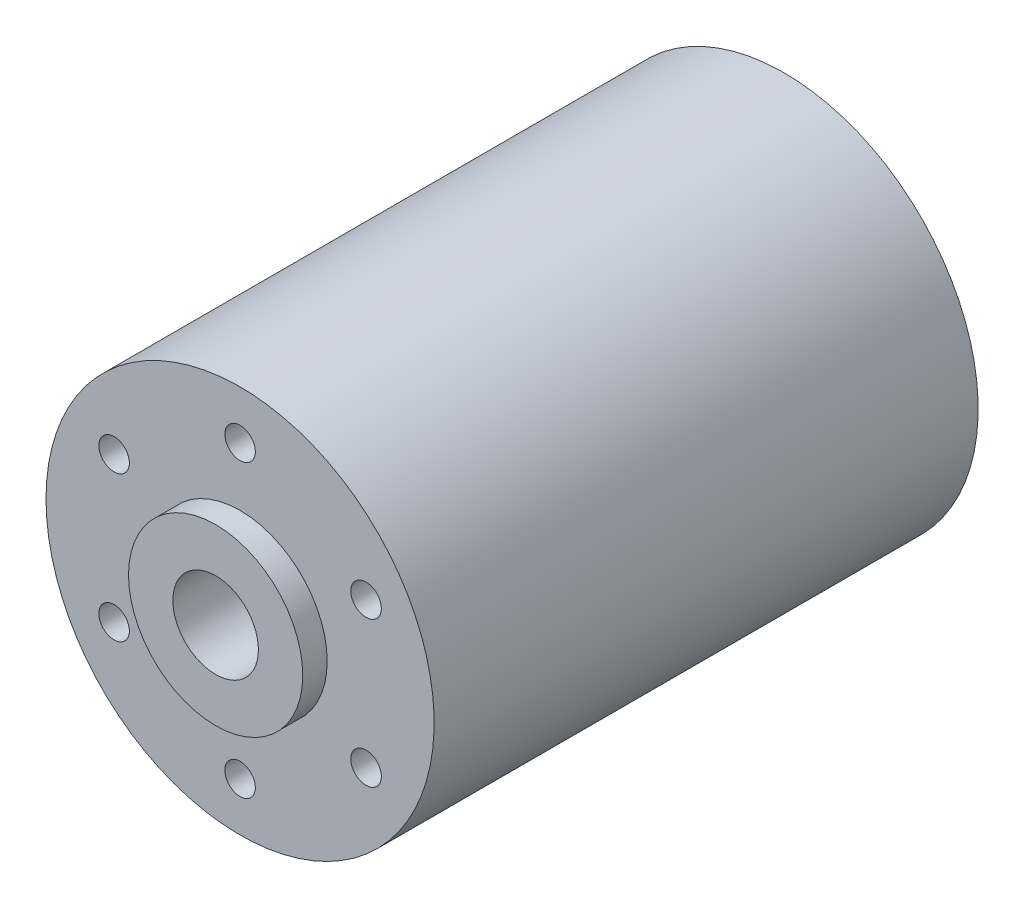
from build123d import *

# Parameters (mm, degrees)
CROQUIS3_R              = 31.75
SALIENTE_EXTRUIR3_DEPTH = 97
CROQUIS4_R              = 7
CORTAR_EXTRUIR1_DEPTH   = 107.888376356
CROQUIS8_R              = 2.5
CORTAR_EXTRUIR6_DEPTH   = 107.888376356
MATRIZC1_COUNT          = 6
CUT_EXTRUDE1_START      = -4
SKETCH1_R               = 31.75
SKETCH1_R_2             = 14.25
CUT_EXTRUDE1_DEPTH      = 4


with BuildPart() as part:
    # Croquis3 → Saliente-Extruir3 (new body)
    with BuildSketch(Plane.XY):
        with Locations(Location((0, 0, 0), (0, 0, 180))):
            Circle(CROQUIS3_R)
    extrude(amount=SALIENTE_EXTRUIR3_DEPTH)

    # Croquis4 → Cortar-Extruir1 (cut, through all)
    with BuildSketch(Plane.XY.offset(97)):
        Circle(CROQUIS4_R)
    extrude(amount=-CORTAR_EXTRUIR1_DEPTH, mode=Mode.SUBTRACT)

    # Croquis8 → Cortar-Extruir6 (cut, through all)
    with BuildSketch(Plane.XY.offset(97)):
        with Locations((0, 23.8)):
            Circle(CROQUIS8_R)
    cortar_extruir6 = extrude(amount=-CORTAR_EXTRUIR6_DEPTH, mode=Mode.SUBTRACT)

    # MatrizC1: Cortar-Extruir6 ×6 about axis
    matrizc1_axis = Axis((0, 0, 0), (0, 0, 1))
    for i in range(1, MATRIZC1_COUNT):
        add(cortar_extruir6.rotate(matrizc1_axis, i * 360 / MATRIZC1_COUNT), mode=Mode.SUBTRACT)

    # Sketch1 → Cut-Extrude1 (cut)
    with BuildSketch(Plane.XY.offset(97).offset(CUT_EXTRUDE1_START)):
        with Locations(Location((0, 0, 0), (0, 0, 180))):
            Circle(SKETCH1_R)
        Circle(SKETCH1_R_2, mode=Mode.SUBTRACT)
    cut_extrude1 = extrude(amount=CUT_EXTRUDE1_DEPTH, mode=Mode.SUBTRACT)

    # Mirror1: Cut-Extrude1 across plane
    add(cut_extrude1.mirror(Plane.XY.offset(48.5)), mode=Mode.SUBTRACT)


solid = part.part
